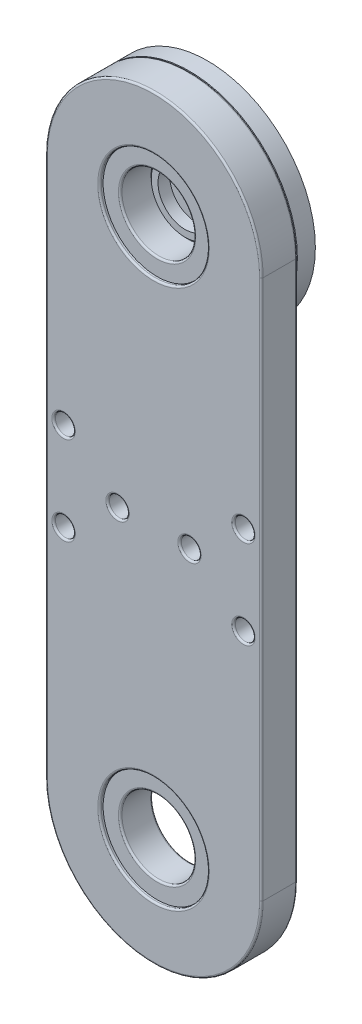
from build123d import *

# Parameters (mm, degrees)
SKETCH_2_R            = 0.75
CUT_EXTRUDE_1_DEPTH   = 18.557049866
SKETCH_1_2_R          = 4.1
EXTRUDE_1_DEPTH       = 4
SKETCH_2_2_R          = 1.1
CUT_EXTRUDE_1_2_DEPTH = 74.131730459
SKETCH_3_R            = 6
CUT_EXTRUDE_2_DEPTH   = 0.4
FILLET_1_R            = 0.2


with BuildPart() as part:
    # Sketch 1 → Повернуть1 (revolve)
    with BuildSketch(Plane(origin=(0, 0, 0), x_dir=(0, 0, -1), z_dir=(1, 0, 0)), mode=Mode.PRIVATE) as revolve_1_sk:
        Polygon((0, 3.75), (0, 12), (2, 12), (2, 4.5), (4.5, 4.5), (4.5, 3), (1.5, 3), (1.5, 1.4), (0.8, 1.4), (0.8, 3), (-0.5, 3), (-0.5, 3.75), align=None)
    revolve(revolve_1_sk.sketch.rotate(Axis((0, 0, 50), (0, 0, -1)), 90), axis=Axis((0, 0, 50), (0, 0, -1)))

    # Sketch 2 → Cut-Extrude 1 (cut, through all)
    with BuildSketch(Plane.XY):
        with Locations((8.25, 0)):
            Circle(SKETCH_2_R)
        with Locations((7.752464121, -2.821666182)):
            Circle(SKETCH_2_R)
        with Locations((7.752464121, 2.821666182)):
            Circle(SKETCH_2_R)
        with Locations((-8.25, 0)):
            Circle(SKETCH_2_R)
        with Locations((-7.752464121, -2.821666182)):
            Circle(SKETCH_2_R)
        with Locations((-7.752464121, 2.821666182)):
            Circle(SKETCH_2_R)
        with Locations((0, 7)):
            Circle(SKETCH_2_R)
        with Locations((0, 10)):
            Circle(SKETCH_2_R)
        with Locations((2.394141003, 6.577848346)):
            Circle(SKETCH_2_R)
        with Locations((3.420201433, 9.396926208)):
            Circle(SKETCH_2_R)
        with Locations((-2.394141003, 6.577848346)):
            Circle(SKETCH_2_R)
        with Locations((-3.420201433, 9.396926208)):
            Circle(SKETCH_2_R)
        with Locations((0, -7)):
            Circle(SKETCH_2_R)
        with Locations((0, -10)):
            Circle(SKETCH_2_R)
        with Locations((3.420201433, -9.396926208)):
            Circle(SKETCH_2_R)
        with Locations((2.394141003, -6.577848346)):
            Circle(SKETCH_2_R)
        with Locations((-2.394141003, -6.577848346)):
            Circle(SKETCH_2_R)
        with Locations((-3.420201433, -9.396926208)):
            Circle(SKETCH_2_R)
    extrude(amount=-CUT_EXTRUDE_1_DEPTH, mode=Mode.SUBTRACT)


with BuildPart() as body_2:
    # Sketch 1 2 → 보스-돌출1 (new body)
    with BuildSketch(Plane.XY):
        with BuildLine():
            Line((-12, 0), (-12, -60))
            ThreePointArc((-12, -60), (0, -72), (12, -60))
            Line((12, -60), (12, 0))
            ThreePointArc((12, 0), (0, 12), (-12, 0))
        make_face()
        Circle(SKETCH_1_2_R, mode=Mode.SUBTRACT)
        with Locations((0, -60)):
            Circle(SKETCH_1_2_R, mode=Mode.SUBTRACT)
    extrude(amount=EXTRUDE_1_DEPTH)

    # Sketch 2 2 → Cut-Extrude 1 2 (cut, through all)
    with BuildSketch(Plane(origin=(0, 0, 0), x_dir=(-1, 0, 0), z_dir=(0, 0, -1))):
        with Locations((-10, -25.079872408)):
            Circle(SKETCH_2_2_R)
        with Locations((-4, -30)):
            Circle(SKETCH_2_2_R)
        with Locations((4, -30)):
            Circle(SKETCH_2_2_R)
        with Locations((10, -25.079872408)):
            Circle(SKETCH_2_2_R)
        with Locations((10, -34.920127592)):
            Circle(SKETCH_2_2_R)
        with Locations((-10, -34.920127592)):
            Circle(SKETCH_2_2_R)
    extrude(amount=-CUT_EXTRUDE_1_2_DEPTH, mode=Mode.SUBTRACT)

    # 스케치3 → 컷-돌출2 (cut)
    with BuildSketch(Plane.XY.offset(4)):
        Circle(SKETCH_3_R)
        with Locations((0, -60)):
            Circle(SKETCH_3_R)
    extrude(amount=-CUT_EXTRUDE_2_DEPTH, mode=Mode.SUBTRACT)

    # 필렛1
    fillet_1_edges = [body_2.edges().sort_by_distance(p)[0] for p in [
        (0, 12, 0),
        (12, -30, 0),
        (0, 12, 4),
        (-12, -30, 4),
        (0, -72, 4),
        (11.1, -34.920127592, 4),
        (11.1, -34.920127592, 0),
        (5.1, -30, 4),
        (5.1, -30, 0),
        (-2.9, -30, 4),
        (-2.9, -30, 0),
        (-8.9, -25.079872408, 4),
        (-8.9, -25.079872408, 0),
        (-8.9, -34.920127592, 4),
        (-8.9, -34.920127592, 0),
        (11.1, -25.079872408, 4),
        (11.1, -25.079872408, 0),
        (-4.1, 0, 3.6),
        (-6, 0, 4),
        (-6, -60, 4),
        (-4.1, -60, 3.6),
        (12, -30, 4),
        (-4.1, 0, 0),
        (-4.1, -60, 0),
        (0, -72, 0),
        (-12, -30, 0),
    ]]
    fillet(fillet_1_edges, radius=FILLET_1_R)


solid = Compound([part.part, body_2.part])
